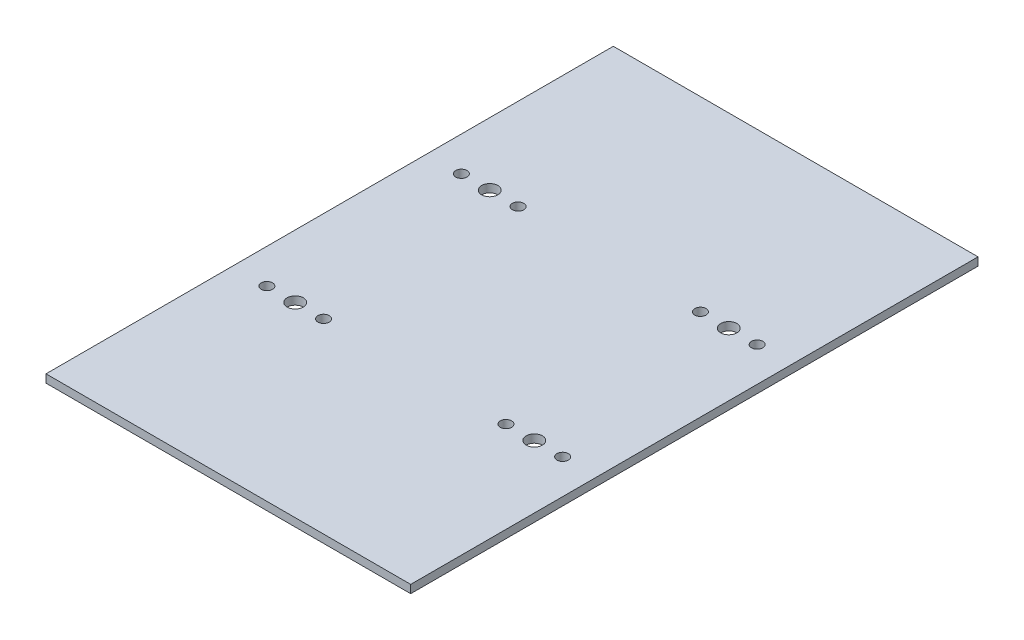
from build123d import *

# Parameters (mm, degrees)
SKETCH1_W           = 90
SKETCH1_H           = 140
SKETCH1_R           = 2
SKETCH1_R_2         = 1.4
BOSS_EXTRUDE1_DEPTH = 2


with BuildPart() as part:
    # Sketch1 → Boss-Extrude1 (new body)
    with BuildSketch(Plane(origin=(0, 0, 0), x_dir=(1, 0, 0), z_dir=(0, 1, 0))):
        Rectangle(SKETCH1_W, SKETCH1_H)
        with Locations(Location((-29.5, 24, 0), (0, 0, 270))):
            Circle(SKETCH1_R, mode=Mode.SUBTRACT)
        with Locations(Location((-36.5, 24, 0), (0, 0, 270))):
            Circle(SKETCH1_R_2, mode=Mode.SUBTRACT)
        with Locations(Location((-22.5, 24, 0), (0, 0, 270))):
            Circle(SKETCH1_R_2, mode=Mode.SUBTRACT)
        with Locations(Location((22.5, 24, 0), (0, 0, 90))):
            Circle(SKETCH1_R_2, mode=Mode.SUBTRACT)
        with Locations(Location((29.5, 24, 0), (0, 0, 90))):
            Circle(SKETCH1_R, mode=Mode.SUBTRACT)
        with Locations(Location((36.5, 24, 0), (0, 0, 90))):
            Circle(SKETCH1_R_2, mode=Mode.SUBTRACT)
        with Locations(Location((36.5, -24, 0), (0, 0, 270))):
            Circle(SKETCH1_R_2, mode=Mode.SUBTRACT)
        with Locations(Location((29.5, -24, 0), (0, 0, 270))):
            Circle(SKETCH1_R, mode=Mode.SUBTRACT)
        with Locations(Location((22.5, -24, 0), (0, 0, 270))):
            Circle(SKETCH1_R_2, mode=Mode.SUBTRACT)
        with Locations(Location((-22.5, -24, 0), (0, 0, 90))):
            Circle(SKETCH1_R_2, mode=Mode.SUBTRACT)
        with Locations(Location((-29.5, -24, 0), (0, 0, 90))):
            Circle(SKETCH1_R, mode=Mode.SUBTRACT)
        with Locations(Location((-36.5, -24, 0), (0, 0, 90))):
            Circle(SKETCH1_R_2, mode=Mode.SUBTRACT)
    extrude(amount=BOSS_EXTRUDE1_DEPTH)


solid = part.part
